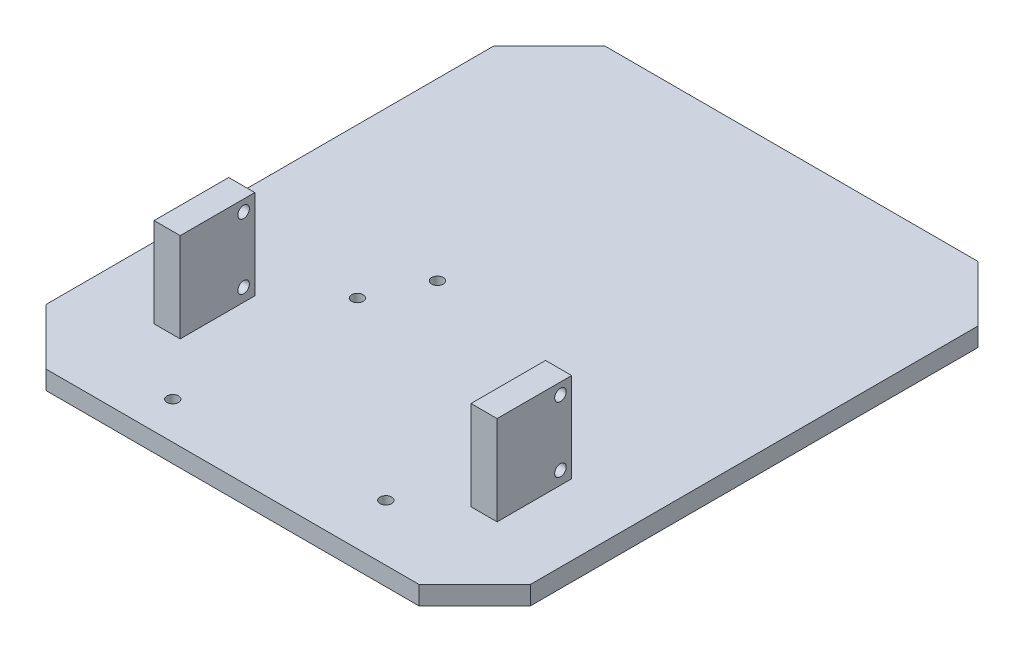
from build123d import *

# Parameters (mm, degrees)
SKETCH1_W           = 130
SKETCH1_H           = 150
BOSS_EXTRUDE1_DEPTH = 2.5
SKETCH4_R           = 1.55
CUT_EXTRUDE2_DEPTH  = 5
SKETCH5_W           = 7
SKETCH5_H           = 20
BOSS_EXTRUDE3_DEPTH = 24
CUT_EXTRUDE3_REACH  = 138.559
SKETCH6_R           = 1.55
CUT_EXTRUDE4_DEPTH  = 5


with BuildPart() as part:
    # Sketch1 → Boss-Extrude1 (new, symmetric)
    with BuildSketch(Plane(origin=(0, 0, 0), x_dir=(1, 0, 0), z_dir=(0, 1, 0))):
        Rectangle(SKETCH1_W, SKETCH1_H)
    extrude(amount=BOSS_EXTRUDE1_DEPTH, both=True)

    # Sketch4 → Cut-Extrude2 (cut)
    with BuildSketch(Plane(origin=(0, 2.5, 0), x_dir=(1, 0, 0), z_dir=(0, 1, 0))):
        with Locations(Location((-24.73, -16.74, 0), (0, 0, 270))):
            Circle(SKETCH4_R)
        with Locations(Location((26.07, -31.98, 0), (0, 0, 270))):
            Circle(SKETCH4_R)
        with Locations(Location((-26, -65, 0), (0, 0, 270))):
            Circle(SKETCH4_R)
        with Locations(Location((26.07, -59.92, 0), (0, 0, 270))):
            Circle(SKETCH4_R)
        with Locations(Location((-18, -2, 0), (0, 0, 270))):
            Circle(SKETCH4_R)
    extrude(amount=-CUT_EXTRUDE2_DEPTH, mode=Mode.SUBTRACT)

    # Sketch5 → Boss-Extrude3 (add)
    with BuildSketch(Plane(origin=(0, 2.5, 0), x_dir=(1, 0, 0), z_dir=(0, 1, 0))):
        with Locations((-42.5, -40)):
            Rectangle(SKETCH5_W, SKETCH5_H)
        with Locations((42.5, -40)):
            Rectangle(SKETCH5_W, SKETCH5_H)
    extrude(amount=BOSS_EXTRUDE3_DEPTH)

    # Cut-Extrude3: up to this face of the body (flat: up to its plane)
    cut_extrude3_end = Plane(part.part.faces().sort_by_distance((46, 14.5, 40))[0])
    # Sketch6 → Cut-Extrude3 (cut, up to the picked face)
    with BuildSketch(Plane.ZY.offset(46), mode=Mode.PRIVATE) as cut_extrude3_sk1:
        with Locations((33, 23.5)):
            Circle(SKETCH6_R)
    cut_extrude3_tool1 = split(extrude(cut_extrude3_sk1.sketch, amount=-CUT_EXTRUDE3_REACH, mode=Mode.PRIVATE), bisect_by=cut_extrude3_end, keep=Keep.BOTH, mode=Mode.PRIVATE)
    # Sketch6 → Cut-Extrude3 (cut, up to the picked face)
    with BuildSketch(Plane.ZY.offset(46), mode=Mode.PRIVATE) as cut_extrude3_sk2:
        with Locations((33, 6)):
            Circle(SKETCH6_R)
    cut_extrude3_tool2 = split(extrude(cut_extrude3_sk2.sketch, amount=-CUT_EXTRUDE3_REACH, mode=Mode.PRIVATE), bisect_by=cut_extrude3_end, keep=Keep.BOTH, mode=Mode.PRIVATE)
    add(cut_extrude3_tool1.solids().sort_by(Axis((-46, 23.5, 33), (1, 0, 0)))[0], mode=Mode.SUBTRACT)
    add(cut_extrude3_tool2.solids().sort_by(Axis((-46, 6, 33), (1, 0, 0)))[0], mode=Mode.SUBTRACT)

    # Sketch7 → Cut-Extrude4 (cut)
    with BuildSketch(Plane(origin=(0, 2.5, 0), x_dir=(1, 0, 0), z_dir=(0, 1, 0))):
        Polygon((-65, -75), (-65, -60), (-50, -75), align=None)
        Polygon((65, -75), (65, -60), (50, -75), align=None)
        Polygon((-65, 75), (-65, 60), (-50, 75), align=None)
        Polygon((65, 75), (65, 60), (50, 75), align=None)
    extrude(amount=-CUT_EXTRUDE4_DEPTH, mode=Mode.SUBTRACT)


solid = part.part
